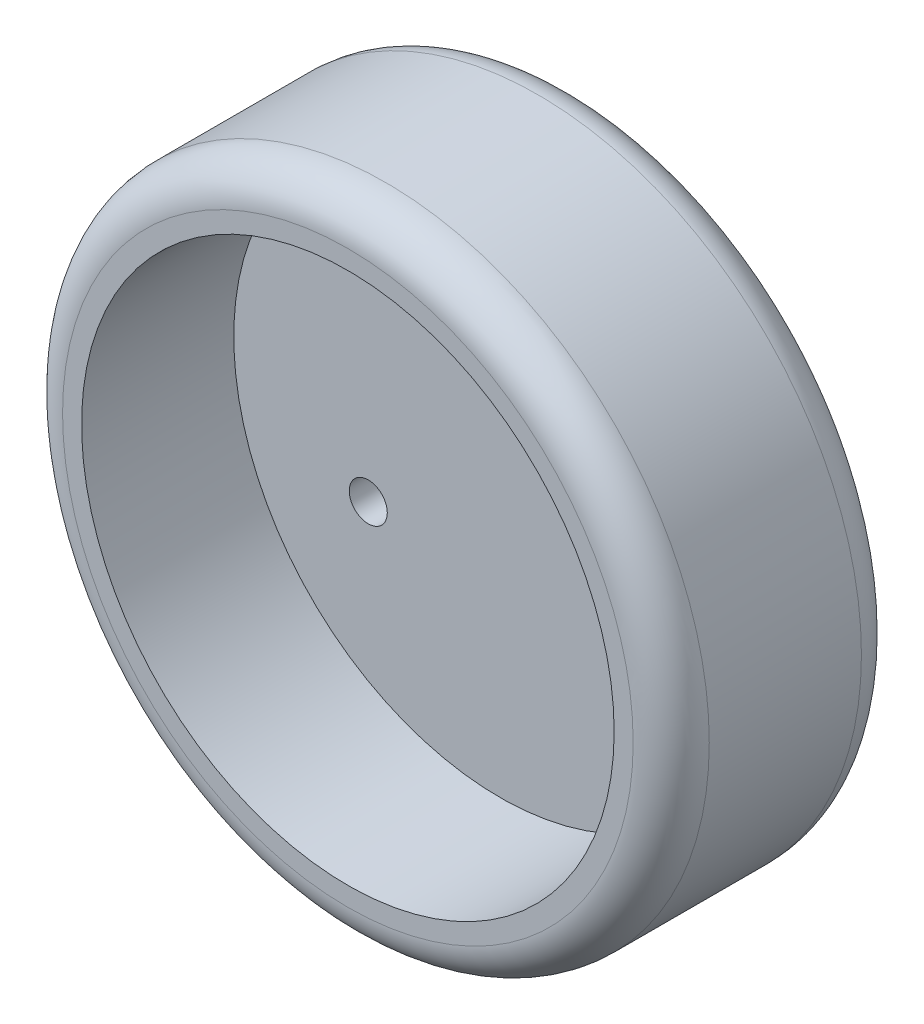
from build123d import *

# Parameters (mm, degrees)
SKETCH2_R           = 42.5
BOSS_EXTRUDE2_DEPTH = 30
SKETCH3_OUTSIDE_W   = 111.78
SKETCH3_OUTSIDE_H   = 111.78
SKETCH3_OUTSIDE_R   = 42.5
SKETCH3_OUTSIDE_R_2 = 35
CUT_EXTRUDE2_DEPTH  = 20
SKETCH8_R           = 2.5
CUT_EXTRUDE3_DEPTH  = 10
FILLET3_R           = 5


with BuildPart() as part:
    # Sketch2 → Boss-Extrude2 (new body)
    with BuildSketch(Plane.XY):
        Circle(SKETCH2_R)
    extrude(amount=BOSS_EXTRUDE2_DEPTH)

    # Sketch3 outside → Cut-Extrude2 (cut)
    # profile 1 of 2: a face of its own
    with BuildSketch(Plane.XY.offset(30)):
        Rectangle(SKETCH3_OUTSIDE_W, SKETCH3_OUTSIDE_H)
        Circle(SKETCH3_OUTSIDE_R, mode=Mode.SUBTRACT)
    # profile 2 of 2: a face of its own
    with BuildSketch(Plane.XY.offset(30)):
        Circle(SKETCH3_OUTSIDE_R_2)
    extrude(amount=-CUT_EXTRUDE2_DEPTH, mode=Mode.SUBTRACT)

    # Sketch8 → Cut-Extrude3 (cut)
    with BuildSketch(Plane.XY.offset(10)):
        with Locations((0, 20)):
            Circle(SKETCH8_R)
        with Locations((17.320508076, -10)):
            Circle(SKETCH8_R)
        with Locations((-17.320508076, -10)):
            Circle(SKETCH8_R)
    extrude(amount=-CUT_EXTRUDE3_DEPTH, mode=Mode.SUBTRACT)

    # Fillet3
    fillet3_edges = [part.edges().sort_by_distance(p)[0] for p in [
        (-42.5, 0, 0),
        (-42.5, 0, 30),
    ]]
    fillet(fillet3_edges, radius=FILLET3_R)


solid = part.part
